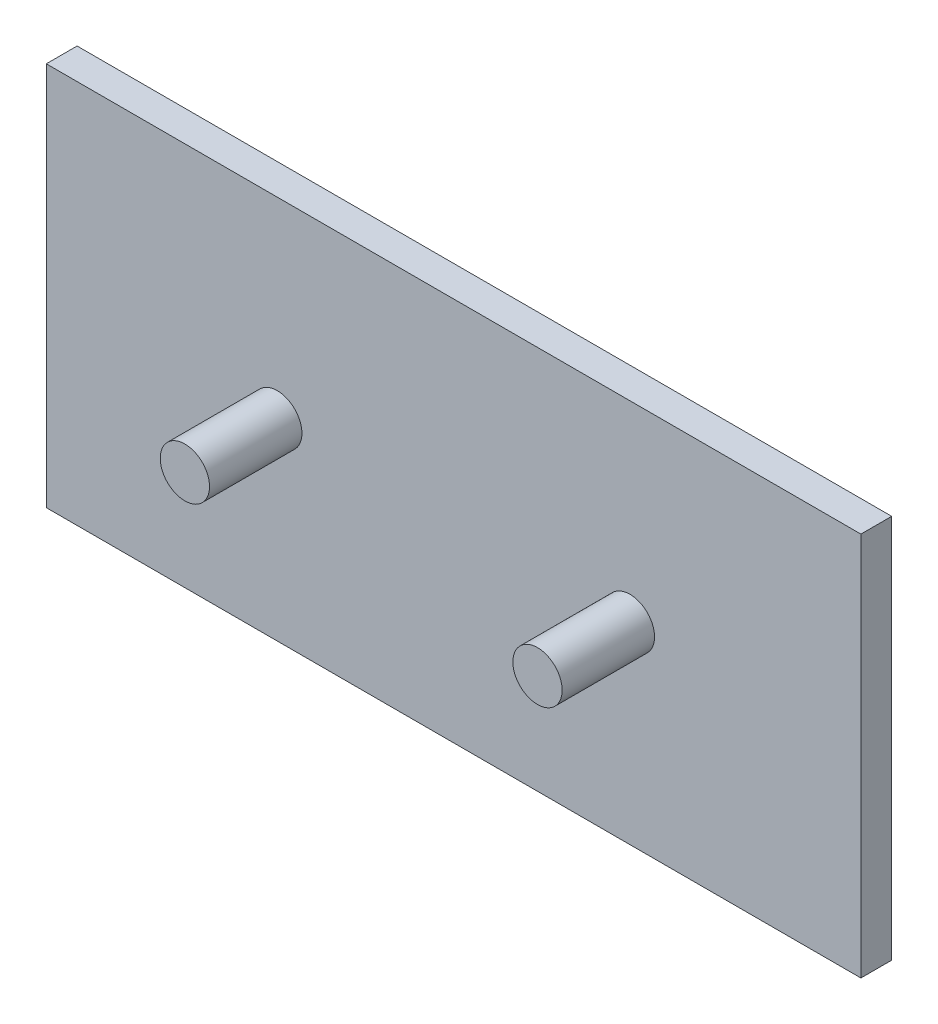
from build123d import *

# Parameters (mm, degrees)
SKETCH1_W           = 132.221839449
SKETCH1_H           = 62.399911756
BOSS_EXTRUDE1_DEPTH = 5
SKETCH2_R           = 4
BOSS_EXTRUDE2_DEPTH = 15


with BuildPart() as part:
    # Sketch1 → Boss-Extrude1 (new body)
    with BuildSketch(Plane.XY):
        with Locations((10.583244946, -0.274889479)):
            Rectangle(SKETCH1_W, SKETCH1_H)
    extrude(amount=BOSS_EXTRUDE1_DEPTH)

    # Sketch2 → Boss-Extrude2 (add)
    with BuildSketch(Plane.XY.offset(5)):
        with Locations((-18.035961804, -0.274889479)):
            Circle(SKETCH2_R)
        with Locations(Location((39.202451695, -0.274889479, 0), (0, 0, 180))):
            Circle(SKETCH2_R)
    extrude(amount=BOSS_EXTRUDE2_DEPTH)


solid = part.part
